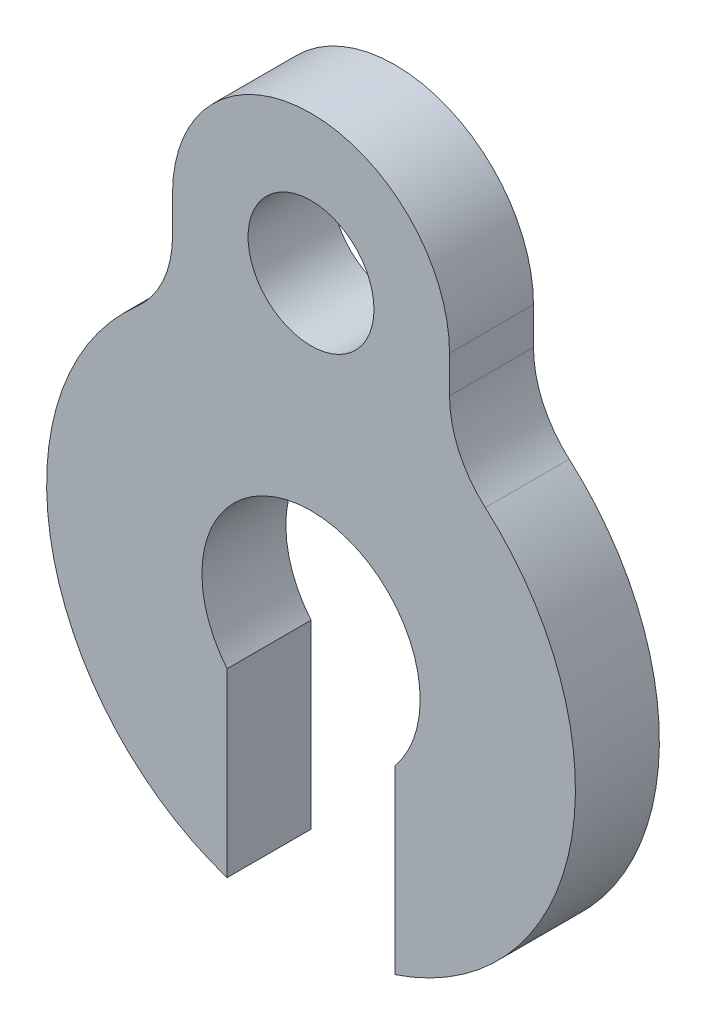
from build123d import *

# Parameters (mm, degrees)
SKETCH1_R           = 0.9525
BOSS_EXTRUDE1_DEPTH = 1.27
FILLET1_R           = 1.5875


with BuildPart() as part:
    # Sketch1 → Boss-Extrude1 (new body)
    with BuildSketch(Plane.XY):
        with BuildLine():
            Line((-1.27, -3.793560366), (-1.27, -1.054941231))
            ThreePointArc((-1.27, -1.054941231), (0, 1.651), (1.27, -1.054941231))
            Line((1.27, -1.054941231), (1.27, -3.793560366))
            ThreePointArc((1.27, -3.793560366), (3.974472125, -0.455600239), (2.0955, 3.407767598))
            Line((2.0955, 3.407767598), (2.0955, 4.7625))
            ThreePointArc((2.0955, 4.7625), (0, 6.858), (-2.0955, 4.7625))
            Line((-2.0955, 4.7625), (-2.0955, 3.407767598))
            ThreePointArc((-2.0955, 3.407767598), (-3.974472125, -0.455600239), (-1.27, -3.793560366))
        make_face()
        with Locations((0, 4.7625)):
            Circle(SKETCH1_R, mode=Mode.SUBTRACT)
    extrude(amount=BOSS_EXTRUDE1_DEPTH)

    # Fillet1
    fillet1_edges = [part.edges().sort_by_distance(p)[0] for p in [
        (-2.0955, 3.407767598, 0.635),
        (2.0955, 3.407767598, 0.635),
    ]]
    fillet(fillet1_edges, radius=FILLET1_R)


solid = part.part
